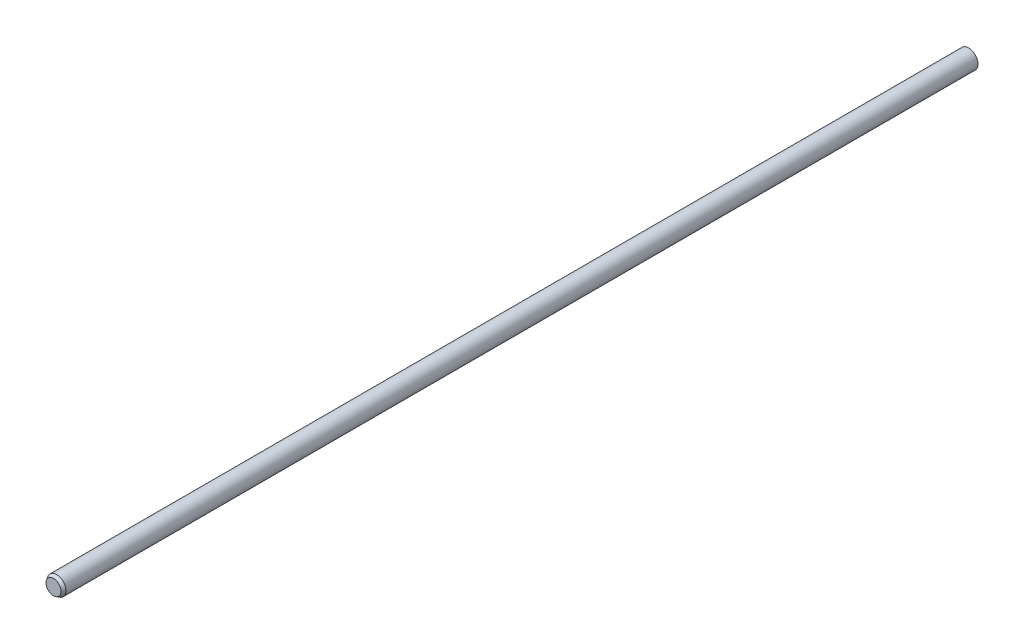
from build123d import *
from OCP.BRepFilletAPI import BRepFilletAPI_MakeChamfer

# Parameters (mm, degrees)
SKETCH1_R           = 3
BOSS_EXTRUDE1_DEPTH = 295
CHAMFER1_SIZE       = 1
CHAMFER1_SIZE2      = 0.577350269


with BuildPart() as part:
    # Sketch1 → Boss-Extrude1 (new body)
    with BuildSketch(Plane.XY):
        Circle(SKETCH1_R)
    extrude(amount=BOSS_EXTRUDE1_DEPTH)

    # Chamfer1: one chamfer whose edges measure the first distance from different faces: ONE call of the kernel's chamfer builder (chamfer() names one face for all edges)
    chamfer1_edges_1 = [part.edges().sort_by_distance(p)[0] for p in [
        (-3, 0, 0),
    ]]
    chamfer1_side_1 = [part.faces().sort_by_distance(p)[0] for p in [
        (0, 0, 0),
    ]]
    chamfer1_edges_2 = [part.edges().sort_by_distance(p)[0] for p in [
        (-3, 0, 295),
    ]]
    chamfer1_side_2 = [part.faces().sort_by_distance(p)[0] for p in [
        (-3, 0, 147.5),
    ]]
    chamfer1 = BRepFilletAPI_MakeChamfer(part.part.solid().wrapped)
    for e in chamfer1_edges_1:
        chamfer1.Add(CHAMFER1_SIZE, CHAMFER1_SIZE2, e.wrapped, chamfer1_side_1[0].wrapped)  # the first distance lies on this face
    for e in chamfer1_edges_2:
        chamfer1.Add(CHAMFER1_SIZE, CHAMFER1_SIZE2, e.wrapped, chamfer1_side_2[0].wrapped)  # the first distance lies on this face
    add(Compound.cast(chamfer1.Shape()), mode=Mode.REPLACE)


solid = part.part
